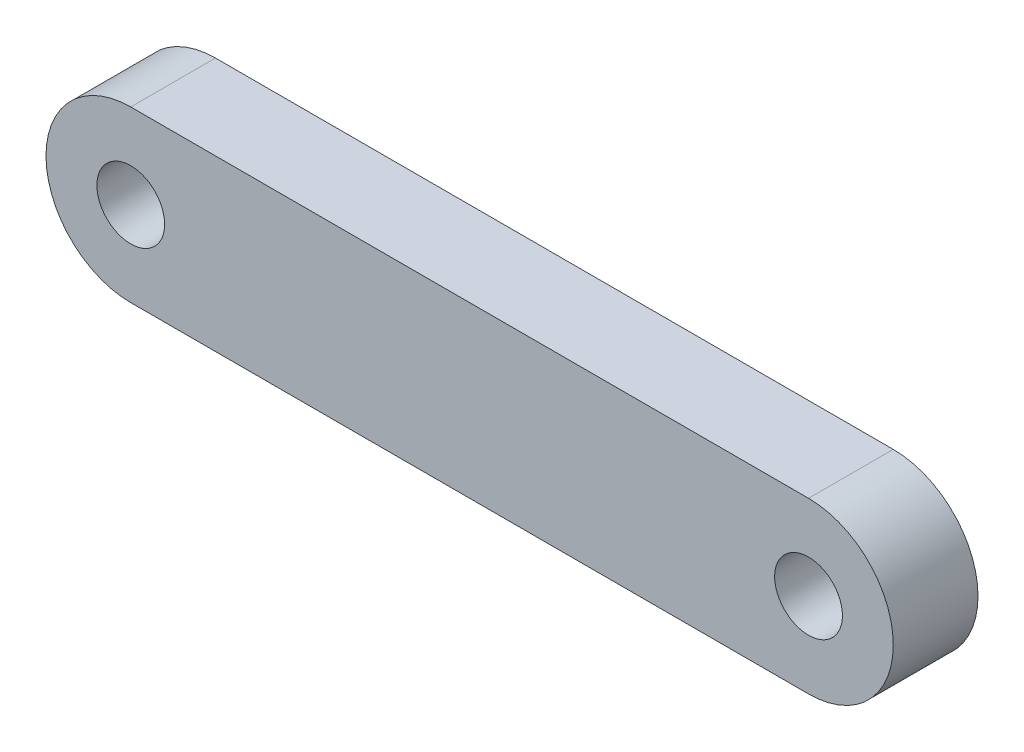
from build123d import *

# Parameters (mm, degrees)
SALIENTE_EXTRUIR1_DEPTH = 5
CROQUIS2_R              = 2
CORTAR_EXTRUIR1_DEPTH   = 5


with BuildPart() as part:
    # Croquis1 → Saliente-Extruir1 (new body)
    with BuildSketch(Plane.XY):
        with BuildLine():
            Line((-16.73660381, 3.181571816), (23.26339619, 3.181571816))
            ThreePointArc((23.26339619, 3.181571816), (28.26339619, -1.818428184), (23.26339619, -6.818428184))
            Line((23.26339619, -6.818428184), (-16.73660381, -6.818428184))
            ThreePointArc((-16.73660381, -6.818428184), (-21.73660381, -1.818428184), (-16.73660381, 3.181571816))
        make_face()
    extrude(amount=SALIENTE_EXTRUIR1_DEPTH)

    # Croquis2 → Cortar-Extruir1 (cut)
    with BuildSketch(Plane.XY.offset(5)):
        with Locations((-16.73660381, -1.818428184)):
            Circle(CROQUIS2_R)
        with Locations((23.26339619, -1.818428184)):
            Circle(CROQUIS2_R)
    extrude(amount=-CORTAR_EXTRUIR1_DEPTH, mode=Mode.SUBTRACT)


solid = part.part
